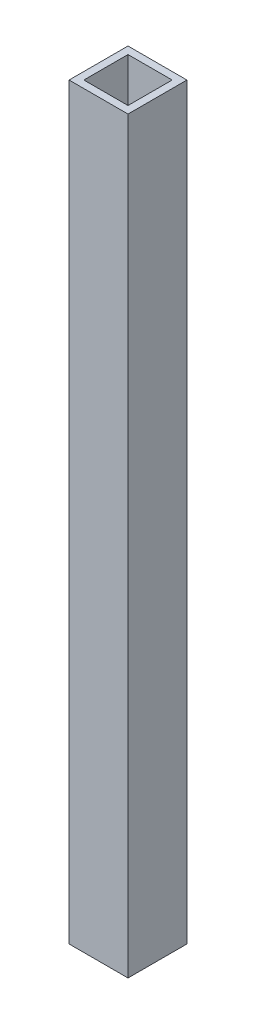
from build123d import *

# Parameters (mm, degrees)
SKETCH1_W           = 8.001
SKETCH1_H           = 8.001
BOSS_EXTRUDE1_DEPTH = 101.6
SKETCH2_W           = 5.9944
SKETCH2_H           = 5.9944
CUT_EXTRUDE1_DEPTH  = 103.228137037


with BuildPart() as part:
    # Sketch1 → Boss-Extrude1 (new body)
    with BuildSketch(Plane(origin=(0, 0, 0), x_dir=(1, 0, 0), z_dir=(0, 1, 0))):
        with Locations((4.0005, 4.0005)):
            Rectangle(SKETCH1_W, SKETCH1_H)
    extrude(amount=BOSS_EXTRUDE1_DEPTH)

    # Sketch2 → Cut-Extrude1 (cut, through all)
    with BuildSketch(Plane(origin=(0, 101.6, 0), x_dir=(1, 0, 0), z_dir=(0, 1, 0))):
        with Locations((4.0005, 4.0005)):
            Rectangle(SKETCH2_W, SKETCH2_H)
    extrude(amount=-CUT_EXTRUDE1_DEPTH, mode=Mode.SUBTRACT)


solid = part.part
